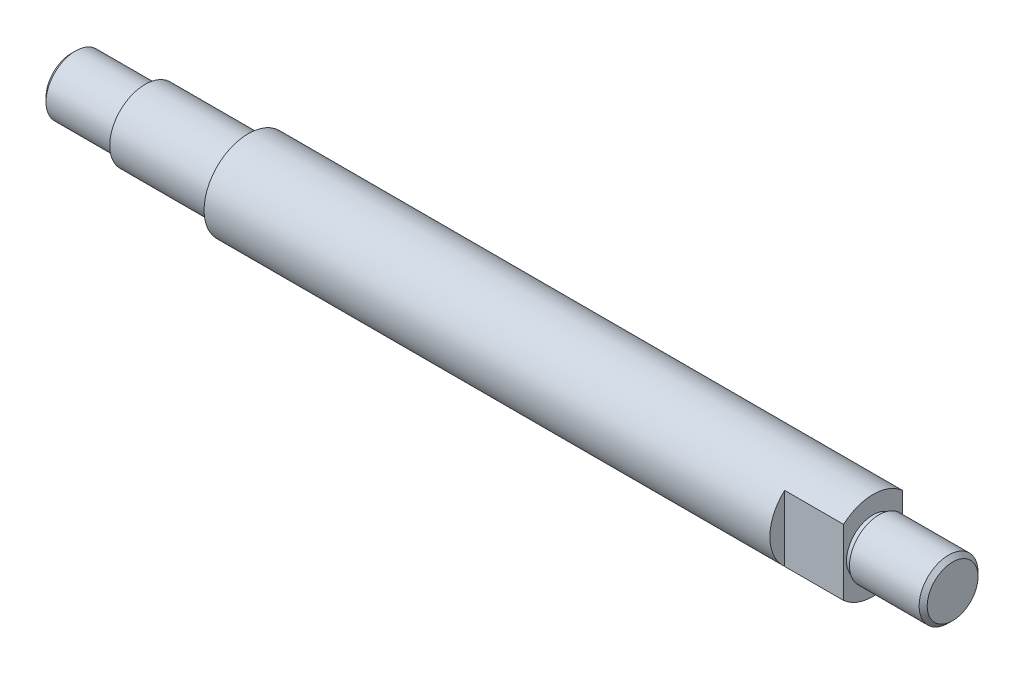
from build123d import *

# Parameters (mm, degrees)
CHAMFER_1_SIZE      = 1.374
SKETCH_2_W          = 22
SKETCH_2_H          = 5
CUT_EXTRUDE_1_DEPTH = 15


with BuildPart() as part:
    # Эскиз1 → Повернуть1 (revolve)
    with BuildSketch(Plane.XY, mode=Mode.PRIVATE) as revolve_1_sk:
        Polygon((0, 0), (299, 0), (299, 10), (274, 10), (274, 9), (272, 9), (272, 15), (60, 15), (60, 12), (25, 12), (25, 10), (0, 10), align=None)
    revolve(revolve_1_sk.sketch.rotate(Axis((-1007.978642663, 0, 0), (1, 0, 0)), 90), axis=Axis((-1007.978642663, 0, 0), (1, 0, 0)))

    # Фаска1
    chamfer_1_edges = [part.edges().sort_by_distance(p)[0] for p in [
        (0, 0, -10),
        (299, 0, -10),
    ]]
    chamfer(chamfer_1_edges, length=CHAMFER_1_SIZE)

    # Эскиз2 → Вырез-Вытянуть1 (cut, symmetric)
    with BuildSketch(Plane(origin=(0, 0, 0), x_dir=(1, 0, 0), z_dir=(0, 1, 0))):
        with Locations((263, 12.5)):
            Rectangle(SKETCH_2_W, SKETCH_2_H)
        with Locations((263, -12.5)):
            Rectangle(SKETCH_2_W, SKETCH_2_H)
    extrude(amount=CUT_EXTRUDE_1_DEPTH, both=True, mode=Mode.SUBTRACT)


solid = part.part
